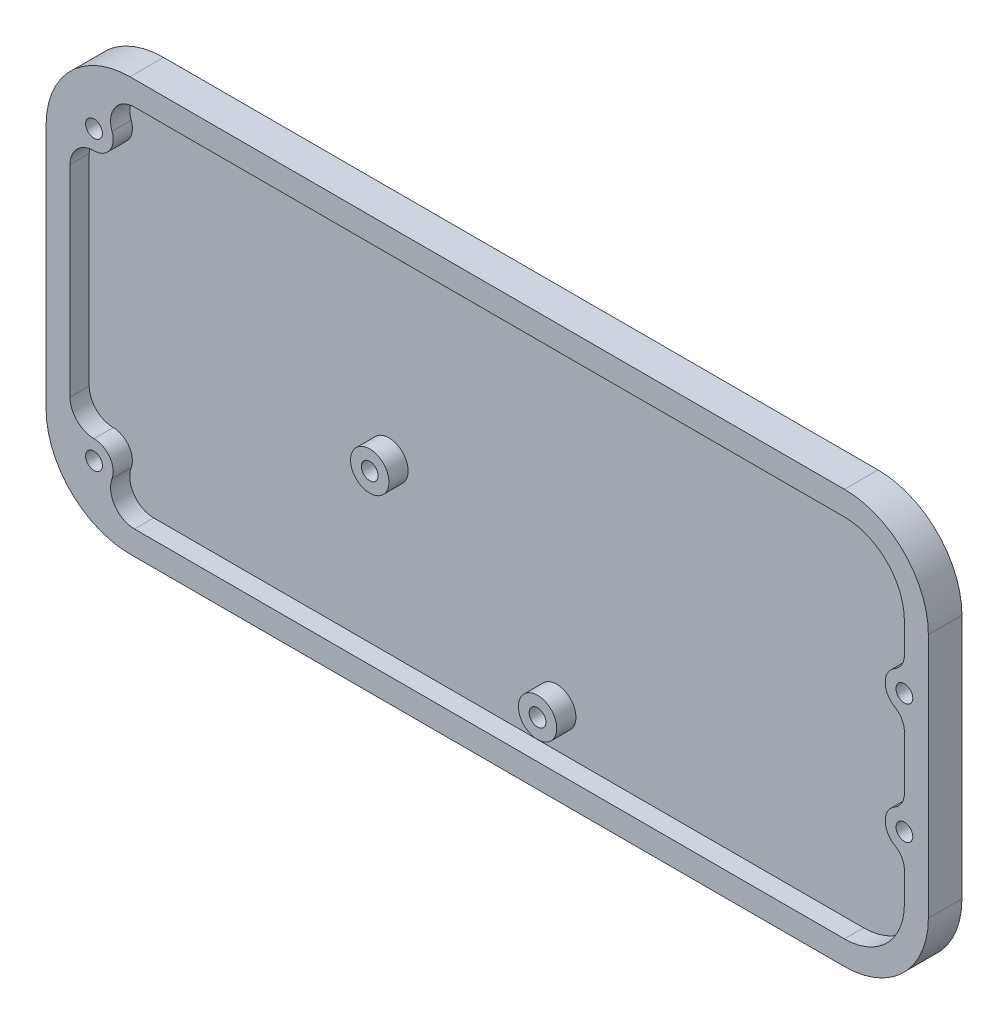
from build123d import *

# Parameters (mm, degrees)
SALIENTE_EXTRUIR1_DEPTH    = 3
CROQUIS2_R                 = 4
SALIENTE_EXTRUIR3_DEPTH    = 4
CORTAR_EXTRUIR1_DEPTH      = 204.311190051
CORTAR_EXTRUIR1_DEPTH_BACK = 204.311190051
CROQUIS3_R                 = 1.75
CROQUIS4_R                 = 3
CORTAR_EXTRUIR2_DEPTH      = 3


with BuildPart() as part:
    # Croquis1 → Saliente-Extruir1 (new body)
    with BuildSketch(Plane.XY):
        with BuildLine():
            Line((17.5, 0), (166.5, 0))
            ThreePointArc((166.5, 0), (178.874368671, 5.125631329), (184, 17.5))
            Line((184, 17.5), (184, 68.7))
            ThreePointArc((184, 68.7), (178.874368671, 81.074368671), (166.5, 86.2))
            Line((166.5, 86.2), (17.5, 86.2))
            ThreePointArc((17.5, 86.2), (5.125631329, 81.074368671), (0, 68.7))
            Line((0, 68.7), (0, 17.5))
            ThreePointArc((0, 17.5), (5.125631329, 5.125631329), (17.5, 0))
        make_face()
    extrude(amount=SALIENTE_EXTRUIR1_DEPTH)

    # Croquis2 → Saliente-Extruir3 (add)
    # profile 1 of 3: a face of its own
    with BuildSketch(Plane.XY.offset(3)):
        with BuildLine():
            ThreePointArc((184, 68.7), (178.874368671, 81.074368671), (166.5, 86.2))
            Line((166.5, 86.2), (17.5, 86.2))
            ThreePointArc((17.5, 86.2), (5.125631329, 81.074368671), (0, 68.7))
            Line((0, 68.7), (0, 17.5))
            ThreePointArc((0, 17.5), (5.125631329, 5.125631329), (17.5, 0))
            Line((17.5, 0), (166.5, 0))
            ThreePointArc((166.5, 0), (178.874368671, 5.125631329), (184, 17.5))
            Line((184, 17.5), (184, 68.7))
        make_face()
        with BuildLine():
            Line((166.5, 5), (18.449260323, 5))
            ThreePointArc((18.449260323, 5), (14.349802364, 7.137405994), (13.75522681, 11.722222222))
            ThreePointArc((13.75522681, 11.722222222), (13.279566367, 15.390075205), (10, 17.1))
            ThreePointArc((10, 17.1), (6.464466094, 18.564466094), (5, 22.1))
            Line((5, 22.1), (5, 64.1))
            ThreePointArc((5, 64.1), (6.464466094, 67.635533906), (10, 69.1))
            ThreePointArc((10, 69.1), (13.279566367, 70.809924795), (13.75522681, 74.477777778))
            ThreePointArc((13.75522681, 74.477777778), (14.349802364, 79.062594006), (18.449260323, 81.2))
            Line((18.449260323, 81.2), (166.5, 81.2))
            ThreePointArc((166.5, 81.2), (175.338834765, 77.538834765), (179, 68.7))
            Line((179, 68.7), (179, 62.52820323))
            ThreePointArc((179, 62.52820323), (178.464101615, 60.52820323), (177, 59.064101615))
            ThreePointArc((177, 59.064101615), (175, 55.6), (177, 52.135898385))
            ThreePointArc((177, 52.135898385), (178.464101615, 50.67179677), (179, 48.67179677))
            Line((179, 48.67179677), (179, 37.52820323))
            ThreePointArc((179, 37.52820323), (178.464101615, 35.52820323), (177, 34.064101615))
            ThreePointArc((177, 34.064101615), (175, 30.6), (177, 27.135898385))
            ThreePointArc((177, 27.135898385), (178.464101615, 25.67179677), (179, 23.67179677))
            Line((179, 23.67179677), (179, 17.5))
            ThreePointArc((179, 17.5), (175.338834765, 8.661165235), (166.5, 5))
        make_face(mode=Mode.SUBTRACT)
    # profile 2 of 3: a face of its own
    with BuildSketch(Plane.XY.offset(3)):
        with Locations(Location((102.5, 13, 0), (0, 0, 180))):
            Circle(CROQUIS2_R)
    # profile 3 of 3: a face of its own
    with BuildSketch(Plane.XY.offset(3)):
        with Locations(Location((67.5, 40, 0), (0, 0, 180))):
            Circle(CROQUIS2_R)
    extrude(amount=SALIENTE_EXTRUIR3_DEPTH)

    # Croquis3 → Cortar-Extruir1 (cut, two sides: drawn at the far end of the back side and taken through both)
    with BuildSketch(Plane.XY.offset(7).offset(-CORTAR_EXTRUIR1_DEPTH_BACK)):
        with Locations((10, 13.1)):
            Circle(CROQUIS3_R)
        with Locations((67.5, 40)):
            Circle(CROQUIS3_R)
        with Locations((102.5, 13)):
            Circle(CROQUIS3_R)
        with Locations((10, 73.1)):
            Circle(CROQUIS3_R)
        with Locations((179, 55.6)):
            Circle(CROQUIS3_R)
        with Locations((179, 30.6)):
            Circle(CROQUIS3_R)
    extrude(amount=CORTAR_EXTRUIR1_DEPTH + CORTAR_EXTRUIR1_DEPTH_BACK, mode=Mode.SUBTRACT)

    # Croquis4 → Cortar-Extruir2 (cut)
    with BuildSketch(Plane(origin=(0, 0, 0), x_dir=(-1, 0, 0), z_dir=(0, 0, -1))):
        with Locations((-179, 30.6)):
            Circle(CROQUIS4_R)
        with Locations((-179, 55.6)):
            Circle(CROQUIS4_R)
        with Locations((-102.5, 13)):
            Circle(CROQUIS4_R)
        with Locations((-67.5, 40)):
            Circle(CROQUIS4_R)
        with Locations((-10, 73.1)):
            Circle(CROQUIS4_R)
        with Locations((-10, 13.1)):
            Circle(CROQUIS4_R)
    extrude(amount=-CORTAR_EXTRUIR2_DEPTH, mode=Mode.SUBTRACT)


solid = part.part
